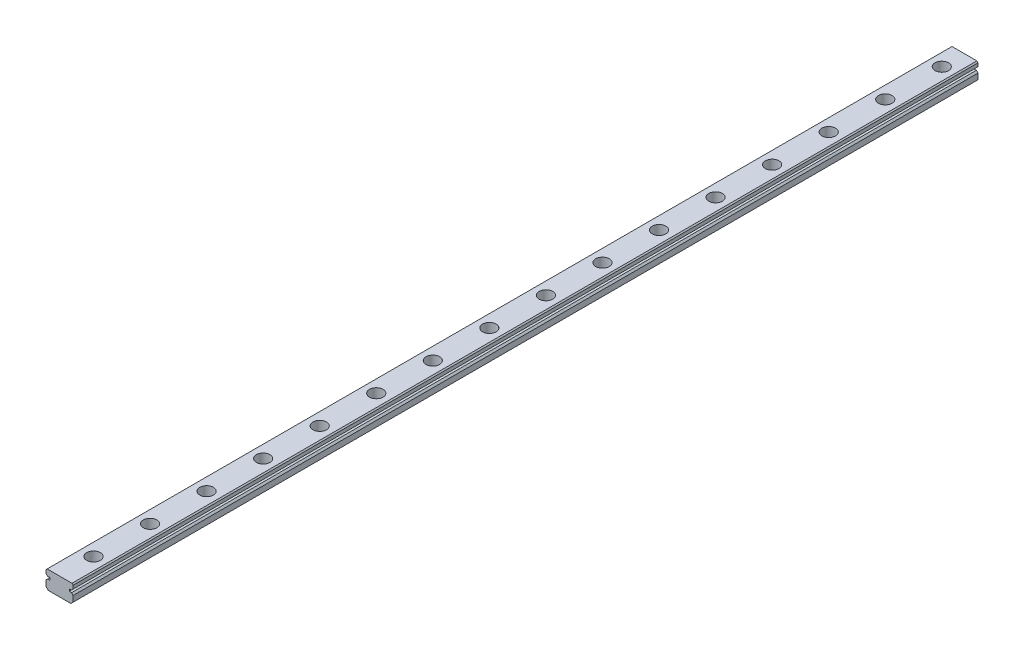
from build123d import *

# Parameters (mm, degrees)
MAIN_EXTRUSION_DEPTH             = 400
MOUNTING_HOLE_MASTER_D           = 3.5
MOUNTING_HOLE_MASTER_DEPTH       = 9.921567416
MOUNTING_HOLE_MASTER_CBORE_D     = 6
MOUNTING_HOLE_MASTER_CBORE_DEPTH = 4.5
MOUNTING_HOLES_PATTERN_COUNT     = 16
MOUNTING_HOLES_PATTERN_PITCH     = 25
RAIL_TOP_CHAMFER_SIZE            = 0.5
RAIL_BOTTOM_CHAMFER_SIZE         = 1


with BuildPart() as part:
    # MainProfile → Main Extrusion (new body)
    with BuildSketch(Plane.XY):
        Polygon((0, 0), (0, 3.585786438), (0.707106781, 4.292893219), (1.707106781, 4.292893219), (1.707106781, 5.292893219), (0.707106781, 5.292893219), (0, 6), (0, 8), (12, 8), (12, 6), (11.292893219, 5.292893219), (10.292893219, 5.292893219), (10.292893219, 4.292893219), (11.292893219, 4.292893219), (12, 3.585786438), (12, 0), align=None)
    extrude(amount=MAIN_EXTRUSION_DEPTH)

    # Mounting Hole Master
    with Locations(Plane(origin=(0, 8, 0), x_dir=(1, 0, 0), z_dir=(0, 1, 0))):
        with Locations((6, -10)):
            mounting_hole_master = CounterBoreHole(MOUNTING_HOLE_MASTER_D / 2, MOUNTING_HOLE_MASTER_CBORE_D / 2, MOUNTING_HOLE_MASTER_CBORE_DEPTH, depth=MOUNTING_HOLE_MASTER_DEPTH)

    # Mounting Holes Pattern: Mounting Hole Master ×16
    with Locations(*[(0, 0, i * MOUNTING_HOLES_PATTERN_PITCH) for i in range(1, MOUNTING_HOLES_PATTERN_COUNT)]):
        add(mounting_hole_master, mode=Mode.SUBTRACT)

    # Rail Top Chamfer
    rail_top_chamfer_edges = [part.edges().sort_by_distance(p)[0] for p in [
        (12, 8, 200),
        (0, 8, 200),
    ]]
    chamfer(rail_top_chamfer_edges, length=RAIL_TOP_CHAMFER_SIZE)

    # Rail Bottom Chamfer
    rail_bottom_chamfer_edges = [part.edges().sort_by_distance(p)[0] for p in [
        (0, 0, 200),
        (12, 0, 200),
    ]]
    chamfer(rail_bottom_chamfer_edges, length=RAIL_BOTTOM_CHAMFER_SIZE)


solid = part.part
